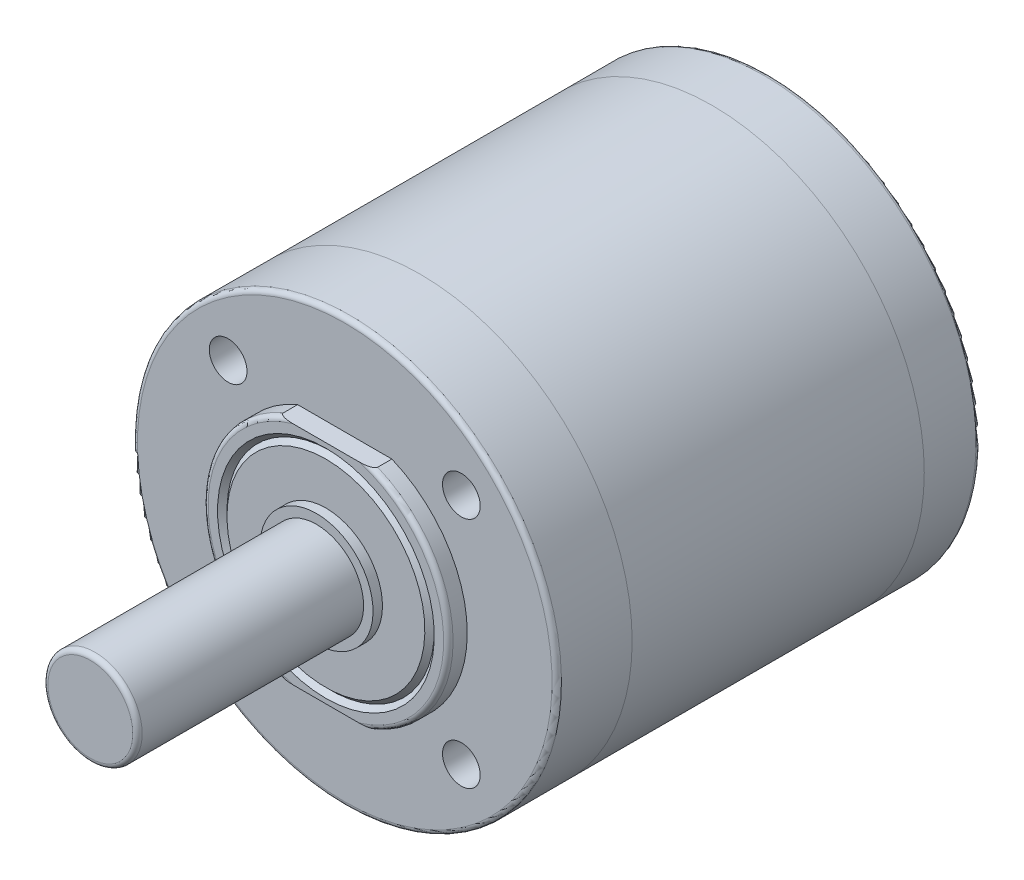
from build123d import *

# Parameters (mm, degrees)
FILLET1_R          = 0.5
CUT_EXTRUDE1_DEPTH = 2
SKETCH4_R          = 2
CUT_EXTRUDE2_DEPTH = 8


with BuildPart() as part:
    # Sketch1 → Revolve1 (revolve)
    with BuildSketch(Plane(origin=(0, 0, 0), x_dir=(0, 0, -1), z_dir=(1, 0, 0))):
        Polygon((0, 0), (0, 22.5), (-45, 22.5), (-45, 13), (-47, 13), (-47, 11.5), (-46.5, 11), (-47, 10.5), (-47, 6), (-48, 6), (-48, 5), (-72, 5), (-72, 0), align=None)
    revolve(axis=Axis((0, 0, 0), (0, 0, 1)))

    # Fillet1
    fillet1_edges = [part.edges().sort_by_distance(p)[0] for p in [
        (0, -5, 72),
        (0, -13, 47),
        (0, -22.5, 45),
        (0, -22.5, 0),
    ]]
    fillet(fillet1_edges, radius=FILLET1_R)

    # Sketch3 → Cut-Extrude1 (cut)
    with BuildSketch(Plane.XY.offset(47)):
        with BuildLine():
            Line((-5, 12), (5, 12))
            ThreePointArc((5, 12), (0, 13), (-5, 12))
        make_face()
        with BuildLine():
            Line((-5, -12), (5, -12))
            ThreePointArc((5, -12), (0, -13), (-5, -12))
        make_face()
    extrude(amount=-CUT_EXTRUDE1_DEPTH, mode=Mode.SUBTRACT)

    # Sketch4 → Cut-Extrude2 (cut)
    with BuildSketch(Plane.XY.offset(45)):
        with Locations((-12.374368671, 12.374368671)):
            Circle(SKETCH4_R)
        with Locations((12.374368671, 12.374368671)):
            Circle(SKETCH4_R)
        with Locations((12.374368671, -12.374368671)):
            Circle(SKETCH4_R)
        with Locations((-12.374368671, -12.374368671)):
            Circle(SKETCH4_R)
    extrude(amount=-CUT_EXTRUDE2_DEPTH, mode=Mode.SUBTRACT)


solid = part.part
